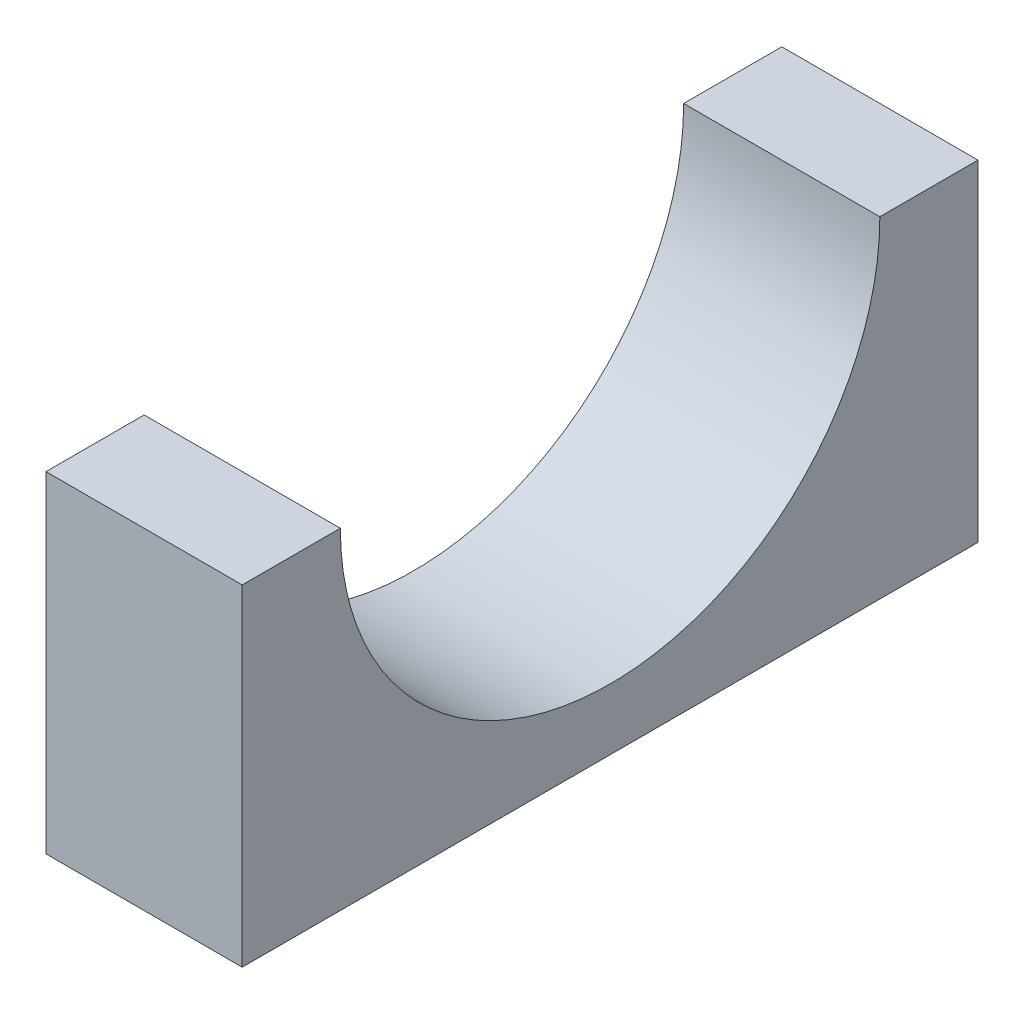
from build123d import *

# Parameters (mm, degrees)
BOSS_EXTRUDE1_DEPTH                = 8
TAP_DRILL_FOR_M2_5X0_45_TAP1_D     = 2.5
TAP_DRILL_FOR_M2_5X0_45_TAP1_DEPTH = 6.5


with BuildPart() as part:
    # Sketch1 → Boss-Extrude1 (new body)
    with BuildSketch(Plane(origin=(0, 0, 0), x_dir=(0, 0, -1), z_dir=(1, 0, 0))):
        with BuildLine():
            Line((-11.002014748, 0), (-15.002014748, 0))
            Line((-15.002014748, 0), (-15.002014748, -13.5))
            Line((-15.002014748, -13.5), (15.001777911, -13.5))
            Line((15.001777911, -13.5), (15.001777911, 0))
            Line((15.001777911, 0), (11.001777911, 0))
            Line((11.001777911, 0), (11, 0))
            ThreePointArc((11, 0), (0, -11), (-11, 0))
            Line((-11, 0), (-11.002014748, 0))
        make_face()
    extrude(amount=BOSS_EXTRUDE1_DEPTH)

    # Tap Drill for M2.5x0.45 Tap1
    with Locations(Plane(origin=(0, -13.5, 0), x_dir=(-1, 0, 0), z_dir=(0, -1, 0))):
        with Locations((-4, -12.502014748), (-4, 12.501777911)):
            Hole(TAP_DRILL_FOR_M2_5X0_45_TAP1_D / 2, depth=TAP_DRILL_FOR_M2_5X0_45_TAP1_DEPTH)


solid = part.part
